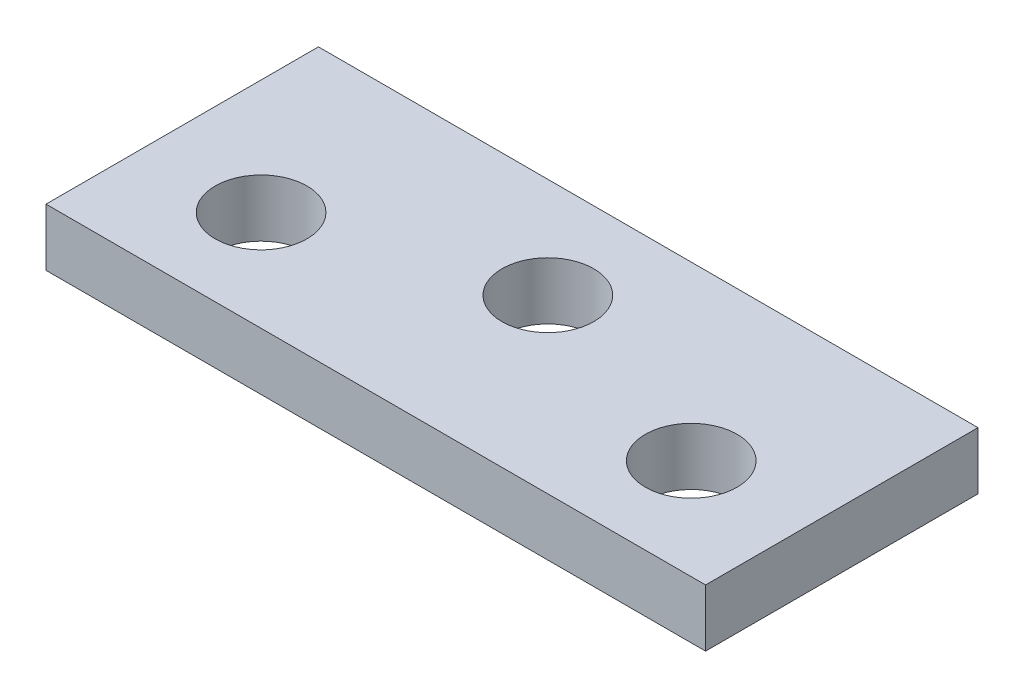
from build123d import *

# Parameters (mm, degrees)
SKETCH_1_W          = 23
SKETCH_1_H          = 9.5
EXTRUDE_1_DEPTH     = 2
SKETCH_2_R          = 1.6
CUT_EXTRUDE_1_DEPTH = 13.602083161


with BuildPart() as part:
    # 草图1 → 凸台-拉伸1 (new body)
    with BuildSketch(Plane(origin=(0, 0, 0), x_dir=(1, 0, 0), z_dir=(0, 1, 0))):
        Rectangle(SKETCH_1_W, SKETCH_1_H)
    extrude(amount=EXTRUDE_1_DEPTH)

    # 草图2 → 切除-拉伸1 (cut, through all)
    with BuildSketch(Plane(origin=(0, 2, 0), x_dir=(1, 0, 0), z_dir=(0, 1, 0))):
        with Locations(Location((-7.5, -1.25, 0), (0, 0, 270))):
            Circle(SKETCH_2_R)
        with Locations(Location((7.5, -1.25, 0), (0, 0, 270))):
            Circle(SKETCH_2_R)
        with Locations(Location((0, 1.25, 0), (0, 0, 270))):
            Circle(SKETCH_2_R)
    extrude(amount=-CUT_EXTRUDE_1_DEPTH, mode=Mode.SUBTRACT)


solid = part.part
